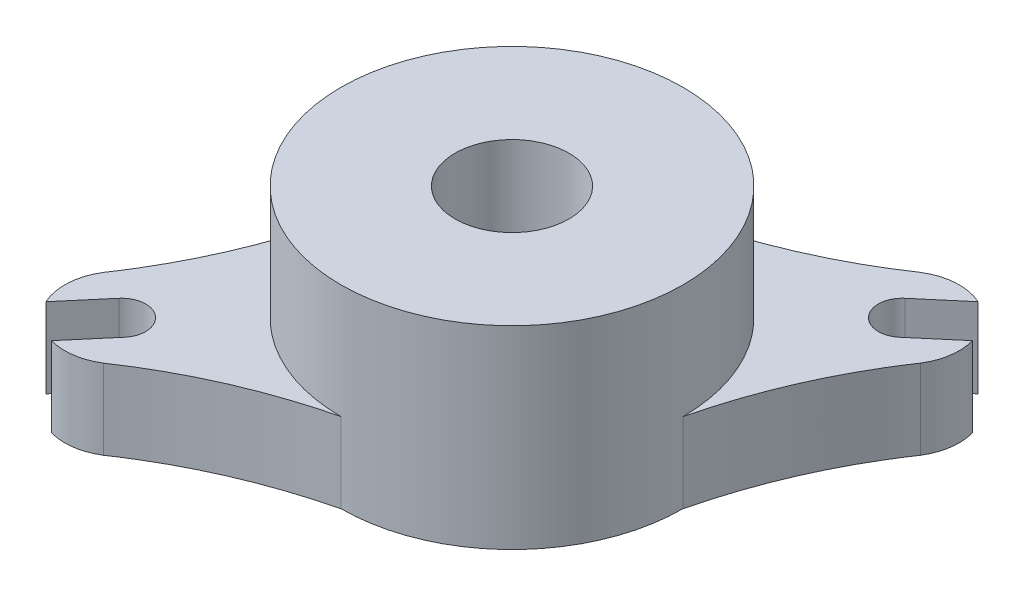
from build123d import *

# Parameters (mm, degrees)
SKETCH1_R           = 19.05
SKETCH1_R_2         = 6.35
SKETCH1_R_3         = 2.667
BOSS_EXTRUDE1_DEPTH = 21.59
CUT_EXTRUDE1_START  = -12.7
SKETCH2_R           = 2.667
CUT_EXTRUDE1_DEPTH  = 12.7
CUT_EXTRUDE2_DEPTH  = 42.695469184
CUT_EXTRUDE3_DEPTH  = 42.695469184


with BuildPart() as part:
    # Sketch1 → Boss-Extrude1 (new body)
    # profile 1 of 3: a face of its own
    with BuildSketch(Plane(origin=(0, 0, 0), x_dir=(1, 0, 0), z_dir=(0, 1, 0))):
        Circle(SKETCH1_R)
        with Locations(Location((0, 0, 0), (0, 0, 270))):
            Circle(SKETCH1_R_2, mode=Mode.SUBTRACT)
    # profile 2 of 3: a face of its own
    with BuildSketch(Plane(origin=(0, 0, 0), x_dir=(1, 0, 0), z_dir=(0, 1, 0))):
        with BuildLine():
            add(Edge.make_bspline(
                [(0, -19.05), (-10.097544885, -21.525800279), (-18.379445047, -27.124937251)],
                knots=[0, 0, 0, 0.663461898, 0.663461898, 0.663461898], degree=2))
            ThreePointArc((0, -19.05), (-13.470384182, -13.470384182), (-19.05, 0))
            add(Edge.make_bspline(
                [(-19.05, 0), (-21.525800279, -10.097544885), (-27.124937251, -18.379445047)],
                knots=[0, 0, 0, 0.663461898, 0.663461898, 0.663461898], degree=2))
            ThreePointArc((-27.124937251, -18.379445047), (-26.222347874, -26.222347874), (-18.379445047, -27.124937251))
        make_face()
        with Locations(Location((-21.732219813, -21.732219813, 0), (0, 0, 270))):
            Circle(SKETCH1_R_3, mode=Mode.SUBTRACT)
    # profile 3 of 3: a face of its own
    with BuildSketch(Plane(origin=(0, 0, 0), x_dir=(1, 0, 0), z_dir=(0, 1, 0))):
        with BuildLine():
            ThreePointArc((0, 19.05), (13.470384182, 13.470384182), (19.05, 0))
            add(Edge.make_bspline(
                [(19.05, 0), (21.525800279, 10.097544885), (27.124937251, 18.379445047)],
                knots=[0, 0, 0, 0.663461898, 0.663461898, 0.663461898], degree=2))
            ThreePointArc((27.124937251, 18.379445047), (26.222347874, 26.222347874), (18.379445047, 27.124937251))
            add(Edge.make_bspline(
                [(0, 19.05), (10.097544885, 21.525800279), (18.379445047, 27.124937251)],
                knots=[0, 0, 0, 0.663461898, 0.663461898, 0.663461898], degree=2))
        make_face()
        with Locations(Location((21.732219813, 21.732219813, 0), (0, 0, 270))):
            Circle(SKETCH1_R_3, mode=Mode.SUBTRACT)
    extrude(amount=BOSS_EXTRUDE1_DEPTH)

    # Sketch2 → Cut-Extrude1 (cut)
    # profile 1 of 2: a face of its own
    with BuildSketch(Plane(origin=(0, 21.59, 0), x_dir=(1, 0, 0), z_dir=(0, 1, 0)).offset(CUT_EXTRUDE1_START)):
        with BuildLine():
            add(Edge.make_bspline(
                [(-18.379445047, -27.124937251), (-10.097544885, -21.525800279), (0, -19.05)],
                knots=[0, 0, 0, 0.663461898, 0.663461898, 0.663461898], degree=2))
            ThreePointArc((0, -19.05), (-13.470384182, -13.470384182), (-19.05, 0))
            add(Edge.make_bspline(
                [(-19.05, 0), (-21.525800279, -10.097544885), (-27.124937251, -18.379445047)],
                knots=[0, 0, 0, 0.663461898, 0.663461898, 0.663461898], degree=2))
            ThreePointArc((-27.124937251, -18.379445047), (-26.222347874, -26.222347874), (-18.379445047, -27.124937251))
        make_face()
        with Locations(Location((-21.732219813, -21.732219813, 0), (0, 0, 270))):
            Circle(SKETCH2_R, mode=Mode.SUBTRACT)
    # profile 2 of 2: a face of its own
    with BuildSketch(Plane(origin=(0, 21.59, 0), x_dir=(1, 0, 0), z_dir=(0, 1, 0)).offset(CUT_EXTRUDE1_START)):
        with BuildLine():
            ThreePointArc((0, 19.05), (13.470384182, 13.470384182), (19.05, 0))
            add(Edge.make_bspline(
                [(19.05, 0), (21.525800279, 10.097544885), (27.124937251, 18.379445047)],
                knots=[0, 0, 0, 0.663461898, 0.663461898, 0.663461898], degree=2))
            ThreePointArc((27.124937251, 18.379445047), (26.222347874, 26.222347874), (18.379445047, 27.124937251))
            add(Edge.make_bspline(
                [(18.379445047, 27.124937251), (10.097544885, 21.525800279), (0, 19.05)],
                knots=[0, 0, 0, 0.663461898, 0.663461898, 0.663461898], degree=2))
        make_face()
        with Locations(Location((21.732219813, 21.732219813, 0), (0, 0, 270))):
            Circle(SKETCH2_R, mode=Mode.SUBTRACT)
    extrude(amount=CUT_EXTRUDE1_DEPTH, mode=Mode.SUBTRACT)

    # Sketch3 → Cut-Extrude2 (cut, through all)
    with BuildSketch(Plane(origin=(0, 8.89, 0), x_dir=(1, 0, 0), z_dir=(0, 1, 0))):
        with BuildLine():
            Line((24.399219813, 27.494997876), (20.006137413, 23.765327914))
            ThreePointArc((20.006137413, 23.765327914), (22.852359813, 24.152586599), (24.399219813, 21.732219813))
            ThreePointArc((24.399219813, 21.732219813), (24.152586599, 20.612079813), (23.458302213, 19.699111712))
            Line((23.458302213, 19.699111712), (27.851384613, 23.428781675))
            ThreePointArc((27.851384613, 23.428781675), (26.572953386, 25.841939813), (24.399219813, 27.494997876))
        make_face()
    extrude(amount=-CUT_EXTRUDE2_DEPTH, mode=Mode.SUBTRACT)

    # Sketch4 → Cut-Extrude3 (cut, through all)
    with BuildSketch(Plane(origin=(0, 8.89, 0), x_dir=(1, 0, 0), z_dir=(0, 1, 0))):
        with BuildLine():
            ThreePointArc((-19.699111712, -23.458302213), (-23.458302213, -23.765327914), (-23.765327914, -20.006137413))
            Line((-23.765327914, -20.006137413), (-27.494997876, -24.399219813))
            ThreePointArc((-27.494997876, -24.399219813), (-25.841939813, -26.572953386), (-23.428781675, -27.851384613))
            Line((-23.428781675, -27.851384613), (-19.699111712, -23.458302213))
        make_face()
    extrude(amount=-CUT_EXTRUDE3_DEPTH, mode=Mode.SUBTRACT)


solid = part.part
